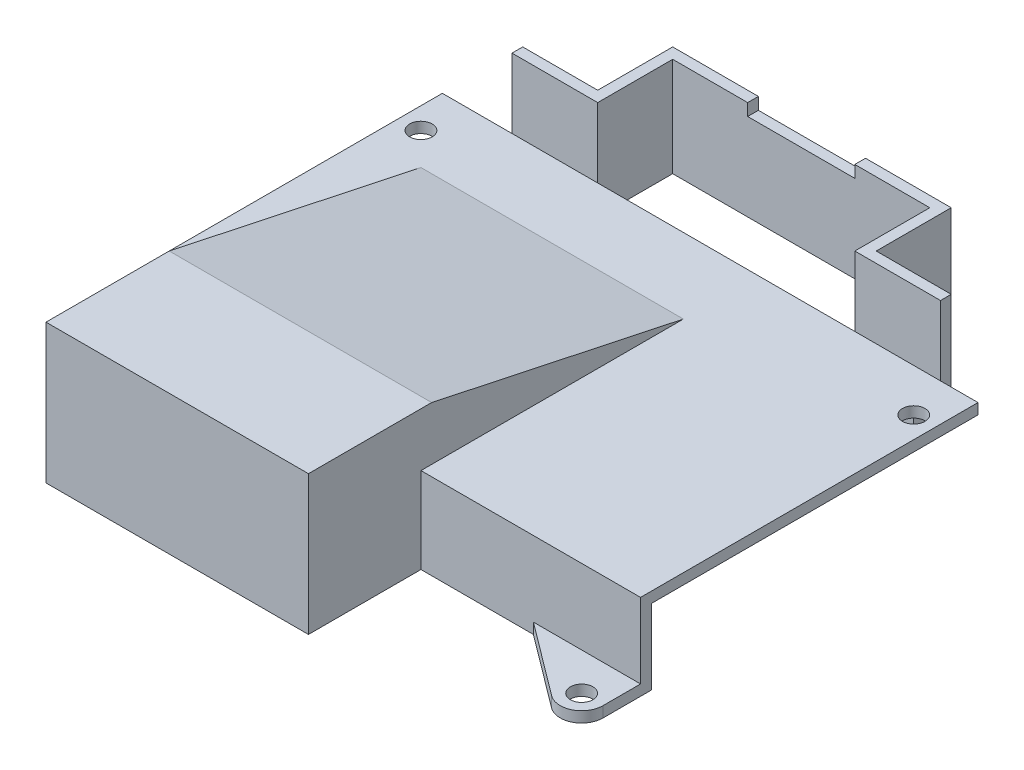
from build123d import *

# Parameters (mm, degrees)
CROQUIS1_R                 = 2.1
SALIENTE_EXTRUIR1_DEPTH    = 2
CROQUIS4_W                 = 49
CROQUIS4_H                 = 23
SALIENTE_EXTRUIR3_DEPTH    = 2
SALIENTE_EXTRUIR4_DEPTH    = 24
CROQUIS7_W                 = 10
CROQUIS7_H                 = 16
CROQUIS7_W_2               = 41
SALIENTE_EXTRUIR5_DEPTH    = 2
CROQUIS8_R                 = 2.1
SALIENTE_EXTRUIR6_DEPTH    = 2
CROQUIS9_W                 = 41
CROQUIS9_H                 = 2
CROQUIS9_W_2               = 10
SALIENTE_EXTRUIR7_DEPTH    = 12
SALIENTE_EXTRUIR8_REACH    = 99.227
SALIENTE_EXTRUIR9_DEPTH    = 2
SALIENTE_EXTRUIR10_DEPTH   = 2
CROQUIS15_W                = 80
CROQUIS15_H                = 8.5
SALIENTE_EXTRUIR11_DEPTH   = 2
CROQUIS16_W                = 48
CROQUIS16_H                = 14
SALIENTE_EXTRUIR12_DEPTH   = 2
SALIENTE_EXTRUIR13_DEPTH   = 16.5
CORTAR_EXTRUIR1_DEPTH      = 116.347301659
CORTAR_EXTRUIR1_DEPTH_BACK = 6


with BuildPart() as part:
    # Croquis1 → Saliente-Extruir1 (new body)
    with BuildSketch(Plane(origin=(0, 0, 0), x_dir=(1, 0, 0), z_dir=(0, 1, 0))):
        Polygon((50, 8), (50, -41), (9, -41), (9, -6), (-40, -6), (-40, -41), (-50, -41), (-50, 8), align=None)
        with Locations(Location((46, 0, 0), (0, 0, 270))):
            Circle(CROQUIS1_R, mode=Mode.SUBTRACT)
        with Locations(Location((-46, 0, 0), (0, 0, 270))):
            Circle(CROQUIS1_R, mode=Mode.SUBTRACT)
    extrude(amount=SALIENTE_EXTRUIR1_DEPTH)



with BuildPart() as body_2:
    # Croquis4 → Saliente-Extruir3 (new body)
    with BuildSketch(Plane(origin=(0, 12, 0), x_dir=(1, 0, 0), z_dir=(0, 1, 0))):
        with Locations((-15.5, -64.5)):
            Rectangle(CROQUIS4_W, CROQUIS4_H)
    extrude(amount=-SALIENTE_EXTRUIR3_DEPTH)

    # Croquis6 → Saliente-Extruir4 (add)
    with BuildSketch(Plane.XZ.offset(-10)):
        Polygon((-38, 74), (7, 74), (7, 53), (9, 53), (9, 76), (-40, 76), (-40, 53), (-38, 53), align=None)
    extrude(amount=SALIENTE_EXTRUIR4_DEPTH)

    # Croquis7 → Saliente-Extruir5 (add)
    with BuildSketch(Plane.XY.offset(53)):
        with Locations((-45, -6)):
            Rectangle(CROQUIS7_W, CROQUIS7_H)
        with Locations((29.5, -6)):
            Rectangle(CROQUIS7_W_2, CROQUIS7_H)
    extrude(amount=SALIENTE_EXTRUIR5_DEPTH)

    # Croquis8 → Saliente-Extruir6 (add)
    # profile 1 of 2: a face of its own
    with BuildSketch(Plane.XZ.offset(14)):
        with BuildLine():
            Line((30, 55), (50, 55))
            Line((50, 55), (50, 62))
            ThreePointArc((50, 62), (47.788854382, 65.577708764), (43.6, 65.2))
            Line((43.6, 65.2), (30, 55))
        make_face()
        with Locations(Location((46, 62, 0), (0, 0, 270))):
            Circle(CROQUIS8_R, mode=Mode.SUBTRACT)
    # profile 2 of 2: a face of its own
    with BuildSketch(Plane.XZ.offset(14)):
        with BuildLine():
            Line((-40, 55), (-40, 76))
            Line((-40, 76), (-49.133743765, 64.485890185))
            ThreePointArc((-49.133743765, 64.485890185), (-49.777232787, 63.316249395), (-50, 62))
            Line((-50, 62), (-50, 55))
            Line((-50, 55), (-40, 55))
        make_face()
        with Locations(Location((-46, 62, 0), (0, 0, 270))):
            Circle(CROQUIS8_R, mode=Mode.SUBTRACT)
    extrude(amount=-SALIENTE_EXTRUIR6_DEPTH)


with BuildPart() as part_1:
    add(part.part)

    add(body_2.part)  # Saliente-Extruir7 merges body 2
    # Croquis9 → Saliente-Extruir7 (add)
    with BuildSketch(Plane.XY.offset(41)):
        with Locations((29.5, 1)):
            Rectangle(CROQUIS9_W, CROQUIS9_H)
        with Locations((-45, 1)):
            Rectangle(CROQUIS9_W_2, CROQUIS9_H)
    extrude(amount=SALIENTE_EXTRUIR7_DEPTH)

    # Saliente-Extruir8: up to this face of the body (flat: up to its plane)
    saliente_extruir8_end = Plane(part_1.part.faces().sort_by_distance((-40, 0.267175573, 65.061068702))[0])
    # Croquis12 → Saliente-Extruir8 (add, up to the picked face)
    with BuildSketch(Plane.ZY.offset(-9), mode=Mode.PRIVATE) as saliente_extruir8_sk1:
        Polygon((53, 10), (53, 12), (6, 2), (6, 0), align=None)
    saliente_extruir8_tool1 = split(extrude(saliente_extruir8_sk1.sketch, amount=SALIENTE_EXTRUIR8_REACH, mode=Mode.PRIVATE), bisect_by=saliente_extruir8_end, keep=Keep.BOTH, mode=Mode.PRIVATE)
    add(saliente_extruir8_tool1.solids().sort_by(Axis((9, 6, 29.5), (-1, 0, 0)))[0])

    # Croquis13 → Saliente-Extruir9 (add)
    with BuildSketch(Plane(origin=(9, 0, 0), x_dir=(0, 0, -1), z_dir=(1, 0, 0))):
        Polygon((-53, 12), (-53, 0), (-6, 0), (-6, 2), align=None)
    extrude(amount=-SALIENTE_EXTRUIR9_DEPTH)

    # Croquis14 → Saliente-Extruir10 (add)
    with BuildSketch(Plane(origin=(-40, 0, 0), x_dir=(0, 0, -1), z_dir=(1, 0, 0))):
        Polygon((-6, 0), (-6, 2), (-53, 10), (-53, 0), align=None)
    extrude(amount=SALIENTE_EXTRUIR10_DEPTH)

    # Croquis15 → Saliente-Extruir11 (add)
    with BuildSketch(Plane(origin=(0, 0, -8), x_dir=(-1, 0, 0), z_dir=(0, 0, -1))):
        with Locations((0, -2.25)):
            Rectangle(CROQUIS15_W, CROQUIS15_H)
    extrude(amount=-SALIENTE_EXTRUIR11_DEPTH)

    # Croquis16 → Saliente-Extruir12 (add)
    with BuildSketch(Plane.XZ.offset(6.5)):
        Polygon((40, -6), (40, -13), (26, -13), (26, -27), (-26, -27), (-26, -13), (-40, -13), (-40, -6), align=None)
        with Locations((0, -18)):
            Rectangle(CROQUIS16_W, CROQUIS16_H, mode=Mode.SUBTRACT)
    extrude(amount=-SALIENTE_EXTRUIR12_DEPTH)

    # Croquis17 → Saliente-Extruir13 (add)
    with BuildSketch(Plane(origin=(0, -4.5, 0), x_dir=(1, 0, 0), z_dir=(0, 1, 0))):
        Polygon((-24, 25), (24, 25), (24, 11), (38.139050544, 11), (40, 11), (40, 13), (26, 13), (26, 27), (-26, 27), (-26, 13), (-40, 13), (-40, 11), (-38.139050544, 11), (-24, 11), align=None)
    extrude(amount=SALIENTE_EXTRUIR13_DEPTH)

    # Croquis18 → Cortar-Extruir1 (cut, two sides: drawn at the far end of the back side and taken through both)
    with BuildSketch(Plane(origin=(0, 0, -27), x_dir=(-1, 0, 0), z_dir=(0, 0, -1)).offset(-CORTAR_EXTRUIR1_DEPTH_BACK)):
        Polygon((-10, 152.782261794), (-10, 12), (-10, 9.75), (10, 9.75), (10, 12), (10, 152.782261794), (10, 434.346785383), (-10, 434.346785383), align=None)
    extrude(amount=CORTAR_EXTRUIR1_DEPTH + CORTAR_EXTRUIR1_DEPTH_BACK, mode=Mode.SUBTRACT)


solid = part_1.part
